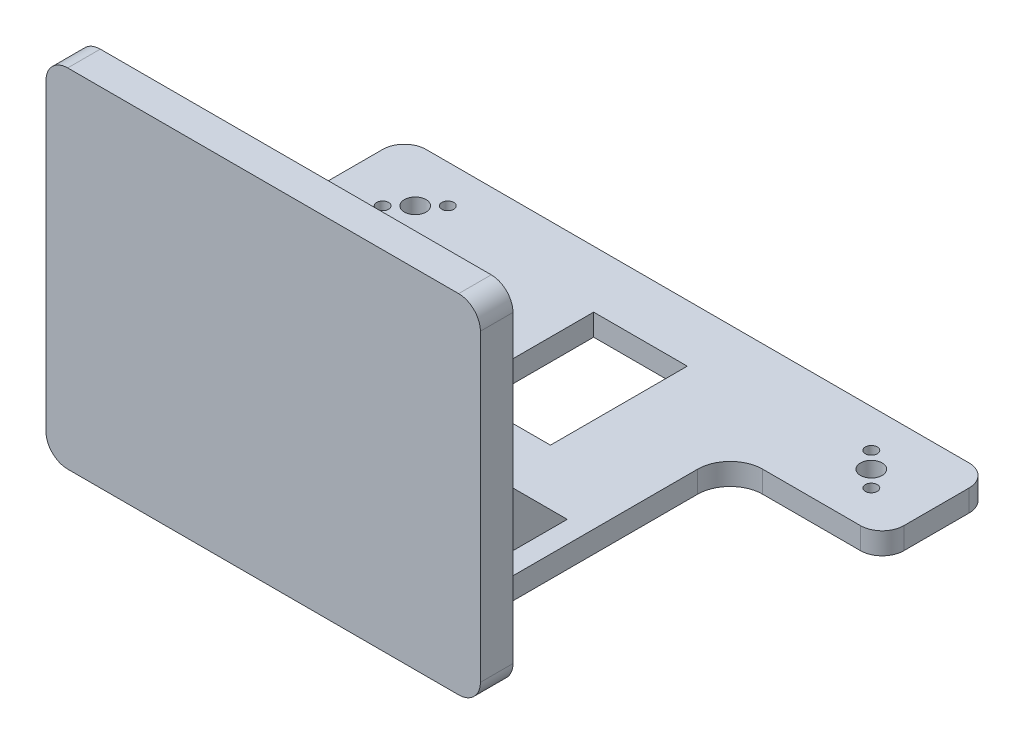
from build123d import *

# Parameters (mm, degrees)
SKIZZE1_R                       = 5
SKIZZE1_R_2                     = 2.75
SKIZZE1_W                       = 43.1
SKIZZE1_H                       = 63
AUFSATZ_LINEAR_AUSTRAGEN1_DEPTH = 10
SKIZZE3_W                       = 200
SKIZZE3_H                       = 15
AUFSATZ_LINEAR_AUSTRAGEN2_DEPTH = 150
VERRUNDUNG1_R                   = 10
AUFSATZ_LINEAR_AUSTRAGEN3_DEPTH = 10
AUFSATZ_LINEAR_AUSTRAGEN4_DEPTH = 10


with BuildPart() as part:
    # Skizze1 → Aufsatz-Linear austragen1 (new body)
    with BuildSketch(Plane(origin=(0, 0, 0), x_dir=(1, 0, 0), z_dir=(0, 1, 0))):
        with BuildLine():
            Line((-125, 100), (125, 100))
            ThreePointArc((125, 100), (132.071067812, 97.071067812), (135, 90))
            Line((135, 90), (135, 60))
            ThreePointArc((135, 60), (132.071067812, 52.928932188), (125, 50))
            Line((125, 50), (80, 50))
            ThreePointArc((80, 50), (69.393398282, 45.606601718), (65, 35))
            Line((65, 35), (65, -70))
            ThreePointArc((65, -70), (69.393398282, -80.606601718), (80, -85))
            Line((80, -85), (90, -85))
            Line((90, -85), (100, -85))
            Line((100, -85), (100, -100))
            Line((100, -100), (80, -100))
            Line((80, -100), (-80, -100))
            Line((-80, -100), (-100, -100))
            Line((-100, -100), (-100, -85))
            Line((-100, -85), (-90, -85))
            Line((-90, -85), (-80, -85))
            ThreePointArc((-80, -85), (-69.393398282, -80.606601718), (-65, -70))
            Line((-65, -70), (-65, 35))
            ThreePointArc((-65, 35), (-69.393398282, 45.606601718), (-80, 50))
            Line((-80, 50), (-125, 50))
            ThreePointArc((-125, 50), (-132.071067812, 52.928932188), (-135, 60))
            Line((-135, 60), (-135, 90))
            ThreePointArc((-135, 90), (-132.071067812, 97.071067812), (-125, 100))
        make_face()
        with Locations(Location((-105, 75, 0), (0, 0, 270))):
            Circle(SKIZZE1_R, mode=Mode.SUBTRACT)
        with Locations(Location((105, 75, 0), (0, 0, 90))):
            Circle(SKIZZE1_R, mode=Mode.SUBTRACT)
        with Locations(Location((-97.5, 82.5, 0), (0, 0, 270))):
            Circle(SKIZZE1_R_2, mode=Mode.SUBTRACT)
        with Locations(Location((-112.5, 67.5, 0), (0, 0, 270))):
            Circle(SKIZZE1_R_2, mode=Mode.SUBTRACT)
        with Locations(Location((97.5, 82.5, 0), (0, 0, 90))):
            Circle(SKIZZE1_R_2, mode=Mode.SUBTRACT)
        with Locations(Location((112.5, 67.5, 0), (0, 0, 90))):
            Circle(SKIZZE1_R_2, mode=Mode.SUBTRACT)
        with Locations((0, 42.21)):
            Rectangle(SKIZZE1_W, SKIZZE1_H, mode=Mode.SUBTRACT)
    extrude(amount=AUFSATZ_LINEAR_AUSTRAGEN1_DEPTH)

    # Skizze3 → Aufsatz-Linear austragen2 (add)
    with BuildSketch(Plane(origin=(0, 10, 0), x_dir=(1, 0, 0), z_dir=(0, 1, 0))):
        with Locations((0, -92.5)):
            Rectangle(SKIZZE3_W, SKIZZE3_H)
    extrude(amount=AUFSATZ_LINEAR_AUSTRAGEN2_DEPTH)

    # Verrundung1
    verrundung1_edges = [part.edges().sort_by_distance(p)[0] for p in [
        (-100, 160, 92.5),
        (100, 160, 92.5),
        (100, 0, 92.5),
        (-100, 0, 92.5),
    ]]
    fillet(verrundung1_edges, radius=VERRUNDUNG1_R)

    # Skizze5 → Aufsatz-Linear austragen3 (add)
    with BuildSketch(Plane.ZY.offset(50)):
        Polygon((15, 10), (85, 80), (85, 10), align=None)
    extrude(amount=-AUFSATZ_LINEAR_AUSTRAGEN3_DEPTH)

    # Skizze6 → Aufsatz-Linear austragen4 (add)
    with BuildSketch(Plane(origin=(55, 0, 0), x_dir=(0, 0, -1), z_dir=(1, 0, 0))):
        Polygon((-15, 10), (-85, 80), (-85, 10), align=None)
    extrude(amount=-AUFSATZ_LINEAR_AUSTRAGEN4_DEPTH)


solid = part.part
